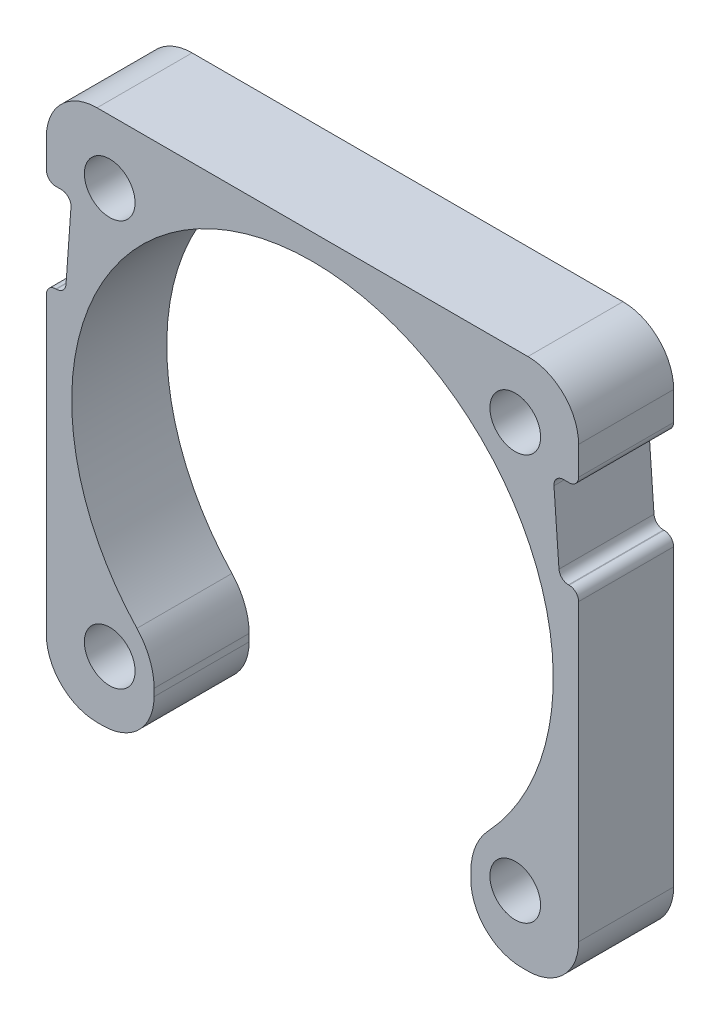
from build123d import *

# Parameters (mm, degrees)
CROQUIS1_W              = 42
CROQUIS1_H              = 42
SALIENTE_EXTRUIR1_DEPTH = 7.5
CROQUIS2_R              = 19
CORTAR_EXTRUIR1_DEPTH   = 31.630866785
CROQUIS3_R              = 2
CORTAR_EXTRUIR2_DEPTH   = 31.630866785
CROQUIS4_W              = 25
CROQUIS4_H              = 33.5
CORTAR_EXTRUIR3_DEPTH   = 31.630866785
REDONDEO1_R             = 4
REDONDEO2_R             = 5
CORTAR_EXTRUIR4_DEPTH   = 31.630866785
REDONDEO3_R             = 0.75


with BuildPart() as part:
    # Croquis1 → Saliente-Extruir1 (new body)
    with BuildSketch(Plane.XY):
        Rectangle(CROQUIS1_W, CROQUIS1_H)
    extrude(amount=SALIENTE_EXTRUIR1_DEPTH)

    # Croquis2 → Cortar-Extruir1 (cut, through all)
    with BuildSketch(Plane.XY.offset(7.5)):
        Circle(CROQUIS2_R)
    extrude(amount=-CORTAR_EXTRUIR1_DEPTH, mode=Mode.SUBTRACT)

    # Croquis3 → Cortar-Extruir2 (cut, through all)
    with BuildSketch(Plane.XY.offset(7.5)):
        with Locations((-16, 16)):
            Circle(CROQUIS3_R)
        with Locations((16, 16)):
            Circle(CROQUIS3_R)
        with Locations((16, -16)):
            Circle(CROQUIS3_R)
        with Locations((-16, -16)):
            Circle(CROQUIS3_R)
    extrude(amount=-CORTAR_EXTRUIR2_DEPTH, mode=Mode.SUBTRACT)

    # Croquis4 → Cortar-Extruir3 (cut, through all)
    with BuildSketch(Plane.XY.offset(7.5)):
        with Locations((0, -4.25)):
            Rectangle(CROQUIS4_W, CROQUIS4_H)
    extrude(amount=-CORTAR_EXTRUIR3_DEPTH, mode=Mode.SUBTRACT)

    # Redondeo1
    redondeo1_edges = [part.edges().sort_by_distance(p)[0] for p in [
        (-12.5, -21, 3.75),
        (12.5, -21, 3.75),
        (-21, 21, 3.75),
        (21, 21, 3.75),
        (21, -21, 3.75),
        (-21, -21, 3.75),
    ]]
    fillet(redondeo1_edges, radius=REDONDEO1_R)

    # Redondeo2
    redondeo2_edges = [part.edges().sort_by_distance(p)[0] for p in [
        (12.5, -14.309088021, 3.75),
        (-12.5, -14.309088021, 3.75),
    ]]
    fillet(redondeo2_edges, radius=REDONDEO2_R)

    # Croquis5 → Cortar-Extruir4 (cut, through all)
    with BuildSketch(Plane.XY.offset(7.5)):
        Polygon((-21, 7), (-21, 14), (-19, 14), (-19.5, 7), align=None)
        Polygon((21, 14), (19, 14), (19.5, 7), (21, 7), align=None)
    extrude(amount=-CORTAR_EXTRUIR4_DEPTH, mode=Mode.SUBTRACT)

    # Redondeo3
    redondeo3_edges = [part.edges().sort_by_distance(p)[0] for p in [
        (-19.5, 7, 3.75),
        (-21, 7, 3.75),
        (-21, 14, 3.75),
        (-19, 14, 3.75),
        (21, 14, 3.75),
        (21, 7, 3.75),
        (19.5, 7, 3.75),
        (19, 14, 3.75),
    ]]
    fillet(redondeo3_edges, radius=REDONDEO3_R)


solid = part.part
